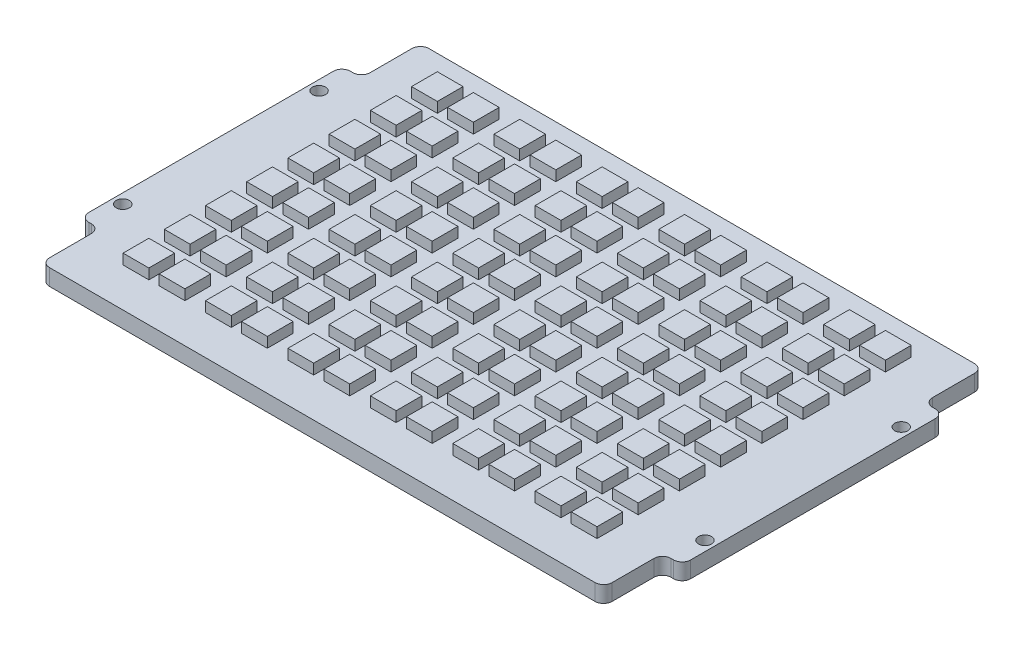
from build123d import *

# Parameters (mm, degrees)
SKETCH1_W            = 109.22
SKETCH1_H            = 73.66
BOSS_EXTRUDE1_DEPTH  = 3.175
BOSS_EXTRUDE3_DEPTH  = 5
LPATTERN1_COUNT      = 6
LPATTERN1_PITCH      = 16
LPATTERN1_COUNT_DIR2 = 8
LPATTERN1_PITCH_DIR2 = 8
SKETCH3_W            = 3.81
SKETCH3_H            = 50.8
SKETCH3_R            = 1.27
BOSS_EXTRUDE2_DEPTH  = 3.175
FILLET1_R            = 1.651


with BuildPart() as part:
    # Sketch1 → Boss-Extrude1 (new body)
    with BuildSketch(Plane(origin=(0, 0, 0), x_dir=(1, 0, 0), z_dir=(0, 1, 0))):
        Rectangle(SKETCH1_W, SKETCH1_H)
    extrude(amount=-BOSS_EXTRUDE1_DEPTH)

    # Sketch2 → Boss-Extrude3 (add)
    with BuildSketch(Plane.XY.offset(-31.75)):
        Polygon((-43.75, 0), (-46.25, 0), (-46.25, 2), (-41.25, 2), (-41.25, 0), align=None)
        Polygon((-39.25, 2), (-34.25, 2), (-34.25, 0), (-36.75, 0), (-39.25, 0), align=None)
    boss_extrude3 = extrude(amount=BOSS_EXTRUDE3_DEPTH)

    # LPattern1: Boss-Extrude3 6 × 8
    with Locations(*[(i * LPATTERN1_PITCH, 0, j * LPATTERN1_PITCH_DIR2) for i in range(LPATTERN1_COUNT) for j in range(LPATTERN1_COUNT_DIR2) if (i, j) != (0, 0)]):
        add(boss_extrude3)

    # Sketch3 → Boss-Extrude2 (add)
    # profile 1 of 2: a face of its own
    with BuildSketch(Plane(origin=(0, 0, 0), x_dir=(1, 0, 0), z_dir=(0, 1, 0))):
        with Locations((-56.515, 0)):
            Rectangle(SKETCH3_W, SKETCH3_H)
        with Locations(Location((-56.515, 19.05, 0), (0, 0, 270))):
            Circle(SKETCH3_R, mode=Mode.SUBTRACT)
        with Locations(Location((-56.515, -19.05, 0), (0, 0, 270))):
            Circle(SKETCH3_R, mode=Mode.SUBTRACT)
    # profile 2 of 2: a face of its own
    with BuildSketch(Plane(origin=(0, 0, 0), x_dir=(1, 0, 0), z_dir=(0, 1, 0))):
        with Locations((56.515, 0)):
            Rectangle(SKETCH3_W, SKETCH3_H)
        with Locations(Location((56.515, -19.05, 0), (0, 0, 90))):
            Circle(SKETCH3_R, mode=Mode.SUBTRACT)
        with Locations(Location((56.515, 19.05, 0), (0, 0, 90))):
            Circle(SKETCH3_R, mode=Mode.SUBTRACT)
    extrude(amount=-BOSS_EXTRUDE2_DEPTH)

    # Fillet1
    fillet1_edges = [part.edges().sort_by_distance(p)[0] for p in [
        (-54.61, -1.5875, -25.4),
        (-54.61, -1.5875, 25.4),
        (-58.42, -1.5875, 25.4),
        (-58.42, -1.5875, -25.4),
        (54.61, -1.5875, -25.4),
        (58.42, -1.5875, -25.4),
        (58.42, -1.5875, 25.4),
        (54.61, -1.5875, 25.4),
        (54.61, -1.5875, 36.83),
        (-54.61, -1.5875, 36.83),
        (-54.61, -1.5875, -36.83),
        (54.61, -1.5875, -36.83),
    ]]
    fillet(fillet1_edges, radius=FILLET1_R)


solid = part.part
